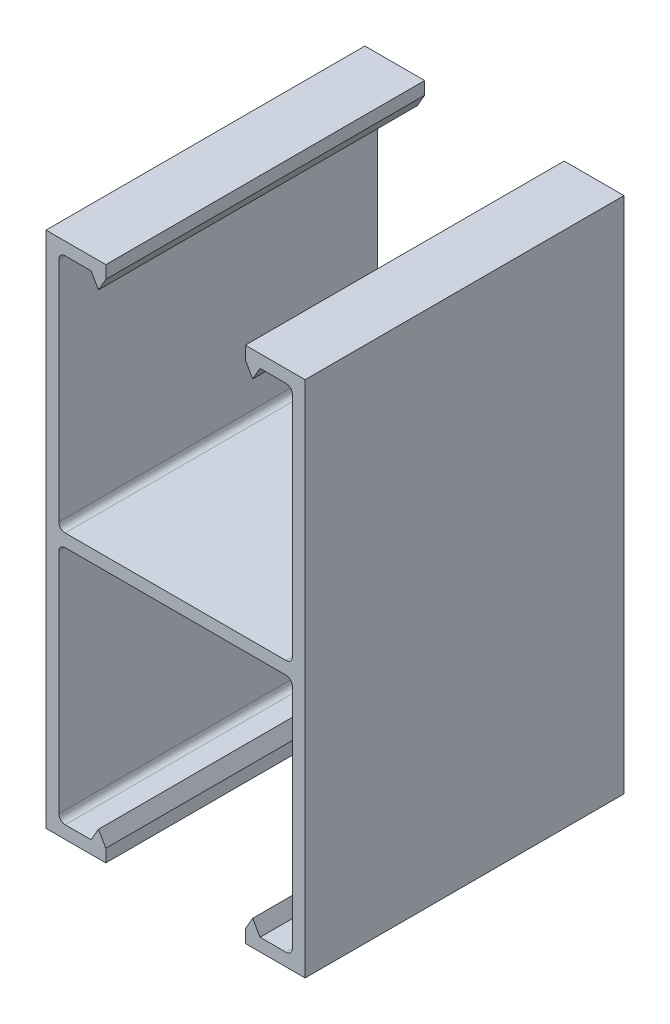
from build123d import *

# Parameters (mm, degrees)
BASE_EXTRUDE_DEPTH = 12.7


with BuildPart() as part:
    # Sketch1 → Base-Extrude (new, symmetric)
    with BuildSketch(Plane.XY):
        with BuildLine():
            Line((-5.55625, 20.6375), (-10.31875, 20.6375))
            Line((-10.31875, 20.6375), (-10.31875, -20.6375))
            Line((-10.31875, -20.6375), (-5.55625, -20.6375))
            Line((-5.55625, -20.6375), (-5.55625, -19.6215))
            Line((-5.55625, -19.6215), (-6.142837874, -18.6055))
            Line((-6.142837874, -18.6055), (-6.729425747, -19.6215))
            Line((-6.729425747, -19.6215), (-8.79475, -19.6215))
            ThreePointArc((-8.79475, -19.6215), (-9.153960245, -19.472710245), (-9.30275, -19.1135))
            Line((-9.30275, -19.1135), (-9.30275, -1.016))
            ThreePointArc((-9.30275, -1.016), (-9.153960245, -0.656789755), (-8.79475, -0.508))
            Line((-8.79475, -0.508), (8.79475, -0.508))
            ThreePointArc((8.79475, -0.508), (9.153960245, -0.656789755), (9.30275, -1.016))
            Line((9.30275, -1.016), (9.30275, -19.1135))
            ThreePointArc((9.30275, -19.1135), (9.153960245, -19.472710245), (8.79475, -19.6215))
            Line((8.79475, -19.6215), (6.729425747, -19.6215))
            Line((6.729425747, -19.6215), (6.142837874, -18.6055))
            Line((6.142837874, -18.6055), (5.55625, -19.6215))
            Line((5.55625, -19.6215), (5.55625, -20.6375))
            Line((5.55625, -20.6375), (10.31875, -20.6375))
            Line((10.31875, -20.6375), (10.31875, 20.6375))
            Line((10.31875, 20.6375), (5.55625, 20.6375))
            Line((5.55625, 20.6375), (5.55625, 19.6215))
            Line((5.55625, 19.6215), (6.142837874, 18.6055))
            Line((6.142837874, 18.6055), (6.729425747, 19.6215))
            Line((6.729425747, 19.6215), (8.79475, 19.6215))
            ThreePointArc((8.79475, 19.6215), (9.153960245, 19.472710245), (9.30275, 19.1135))
            Line((9.30275, 19.1135), (9.30275, 1.016))
            ThreePointArc((9.30275, 1.016), (9.153960245, 0.656789755), (8.79475, 0.508))
            Line((8.79475, 0.508), (-8.79475, 0.508))
            ThreePointArc((-8.79475, 0.508), (-9.153960245, 0.656789755), (-9.30275, 1.016))
            Line((-9.30275, 1.016), (-9.30275, 19.1135))
            ThreePointArc((-9.30275, 19.1135), (-9.153960245, 19.472710245), (-8.79475, 19.6215))
            Line((-8.79475, 19.6215), (-6.729425747, 19.6215))
            Line((-6.729425747, 19.6215), (-6.142837874, 18.6055))
            Line((-6.142837874, 18.6055), (-5.55625, 19.6215))
            Line((-5.55625, 19.6215), (-5.55625, 20.6375))
        make_face()
    extrude(amount=BASE_EXTRUDE_DEPTH, both=True)


solid = part.part
